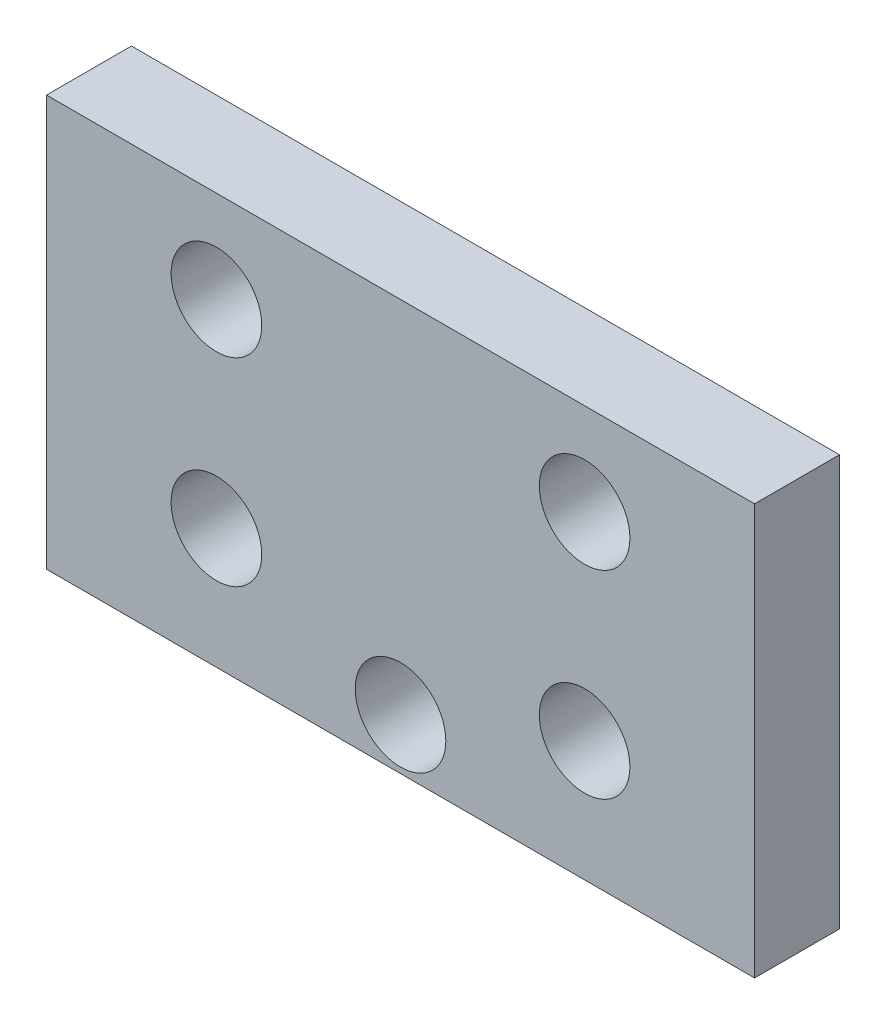
from build123d import *

# Parameters (mm, degrees)
SKETCH_1_W      = 25
SKETCH_1_H      = 14.5
SKETCH_1_R      = 1.6
EXTRUDE_1_DEPTH = 3


with BuildPart() as part:
    # 草图1 → 凸台-拉伸1 (new body)
    with BuildSketch(Plane.XY):
        Rectangle(SKETCH_1_W, SKETCH_1_H)
        with Locations((-6.5, 4)):
            Circle(SKETCH_1_R, mode=Mode.SUBTRACT)
        with Locations((6.5, 4)):
            Circle(SKETCH_1_R, mode=Mode.SUBTRACT)
        with Locations((6.5, -3)):
            Circle(SKETCH_1_R, mode=Mode.SUBTRACT)
        with Locations((0, -5.45)):
            Circle(SKETCH_1_R, mode=Mode.SUBTRACT)
        with Locations((-6.5, -3)):
            Circle(SKETCH_1_R, mode=Mode.SUBTRACT)
    extrude(amount=EXTRUDE_1_DEPTH)


solid = part.part
